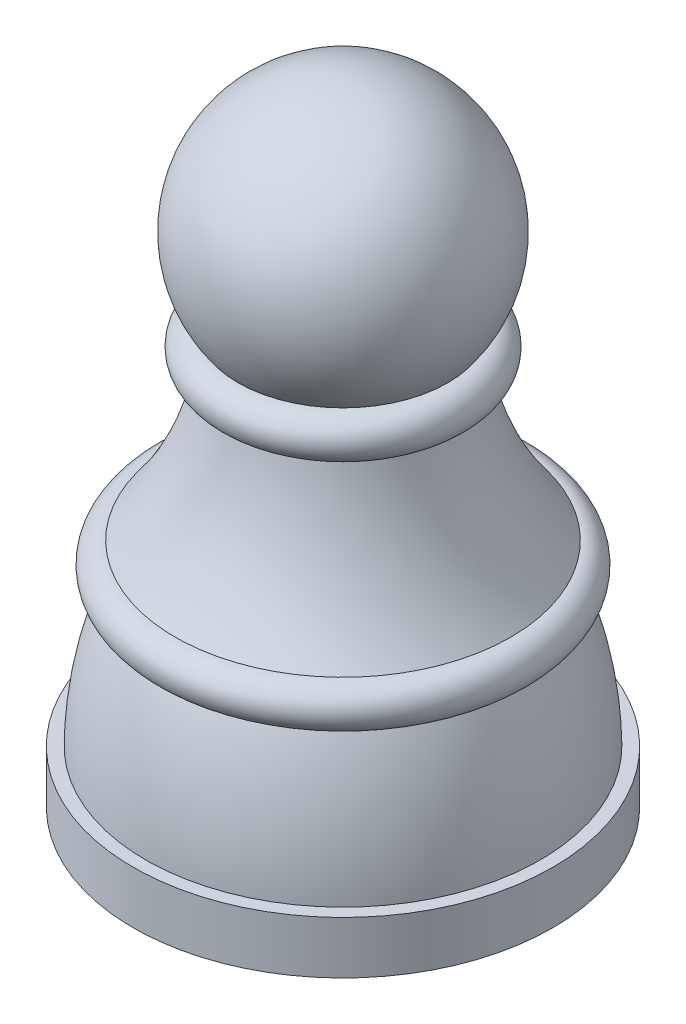
from build123d import *


with BuildPart() as part:
    # Sketch1 → Revolve1 (revolve)
    with BuildSketch(Plane.XY, mode=Mode.PRIVATE) as revolve1_sk:
        with BuildLine():
            Line((0, 0), (12.7, 0))
            Line((12.7, 0), (12.7, 3.175))
            Line((12.7, 3.175), (11.938, 3.175))
            ThreePointArc((11.938, 3.175), (11.460765371, 7.391187926), (10.16, 11.43))
            ThreePointArc((10.16, 11.43), (11.43, 12.7), (10.16, 13.97))
            ThreePointArc((10.16, 13.97), (7.700355765, 18.177295328), (6.35, 22.86))
            ThreePointArc((6.35, 22.86), (7.62, 24.13), (6.35, 25.4))
            ThreePointArc((6.35, 25.4), (7.099515829, 33.712257914), (0, 38.1))
            Line((0, 38.1), (0, 0))
        make_face()
    revolve(revolve1_sk.sketch.rotate(Axis((0, 38.1, 0), (0, -1, 0)), 180), axis=Axis((0, 38.1, 0), (0, -1, 0)))


solid = part.part
